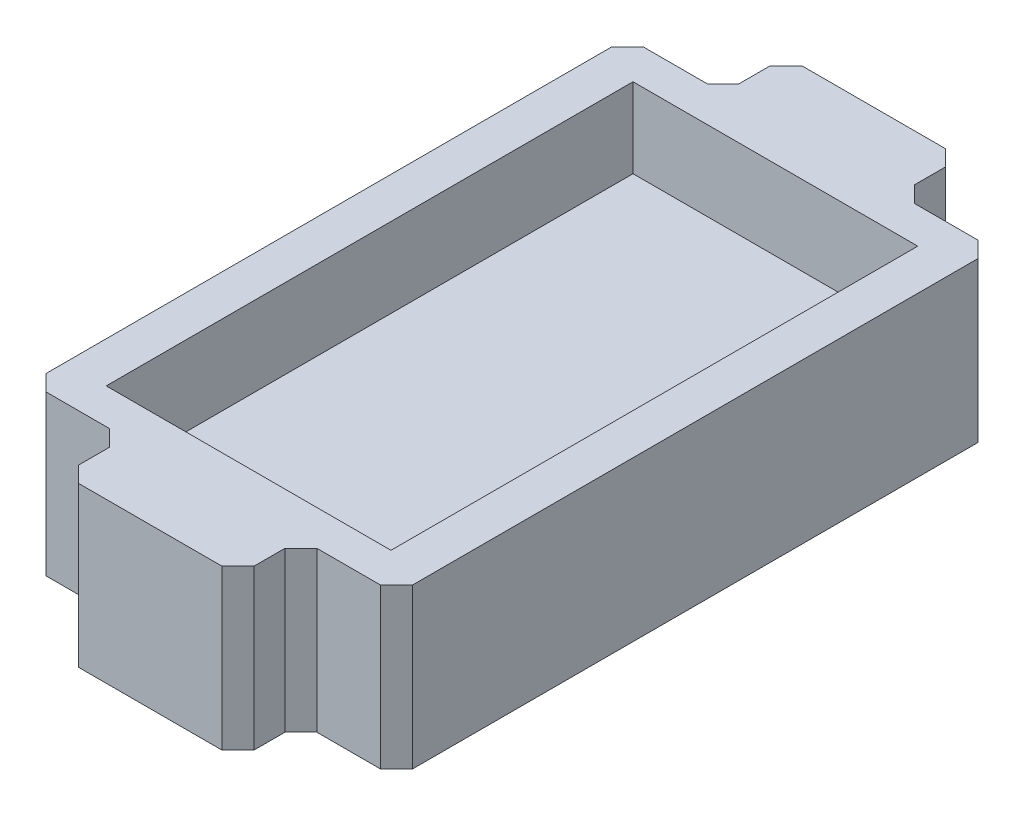
from build123d import *

# Parameters (mm, degrees)
SKETCH_1_W          = 5.5
SKETCH_1_H          = 3.95
EXTRUDE_1_DEPTH     = 10
CHAMFER_1_SIZE      = 1
SKETCH_2_W          = 8.93689146
SKETCH_2_H          = 16.533425066
CUT_EXTRUDE_1_DEPTH = 5


with BuildPart() as part:
    # ｽｹｯﾁ1 → ﾎﾞｽ - 押し出し1 (new body)
    with BuildSketch(Plane(origin=(0, 0, 0), x_dir=(1, 0, 0), z_dir=(0, 1, 0))):
        Polygon((0, 37.5), (0, 18.75), (23, 18.75), (23, 37.5), (17, 37.5), (11.5, 37.5), (6, 37.5), align=None)
        Polygon((0, 18.75), (0, 0), (6, 0), (11.5, 0), (17, 0), (23, 0), (23, 18.75), align=None)
        with Locations((14.25, -1.975)):
            Rectangle(SKETCH_1_W, SKETCH_1_H)
        with Locations((8.75, -1.975)):
            Rectangle(SKETCH_1_W, SKETCH_1_H)
        with Locations((14.25, 39.475)):
            Rectangle(SKETCH_1_W, SKETCH_1_H)
        with Locations((8.75, 39.475)):
            Rectangle(SKETCH_1_W, SKETCH_1_H)
    extrude(amount=EXTRUDE_1_DEPTH)

    # 面取り1
    chamfer_1_edges = [part.edges().sort_by_distance(p)[0] for p in [
        (6, 5, 3.95),
        (6, 5, 0),
        (0, 5, 0),
        (0, 5, -37.5),
        (6, 5, -37.5),
        (6, 5, -41.45),
        (17, 5, -41.45),
        (17, 5, -37.5),
        (23, 5, -37.5),
        (23, 5, 0),
        (17, 5, 0),
        (17, 5, 3.95),
    ]]
    chamfer(chamfer_1_edges, length=CHAMFER_1_SIZE)

    # ｽｹｯﾁ2 → ｶｯﾄ - 押し出し1 (cut)
    with BuildSketch(Plane(origin=(0, 10, 0), x_dir=(1, 0, 0), z_dir=(0, 1, 0))):
        with Locations((7.03155427, 10.483287467)):
            Rectangle(SKETCH_2_W, SKETCH_2_H)
        with Locations((15.96844573, 10.483287467)):
            Rectangle(SKETCH_2_W, SKETCH_2_H)
        with Locations((15.96844573, 27.016712533)):
            Rectangle(SKETCH_2_W, SKETCH_2_H)
        with Locations((7.03155427, 27.016712533)):
            Rectangle(SKETCH_2_W, SKETCH_2_H)
    extrude(amount=-CUT_EXTRUDE_1_DEPTH, mode=Mode.SUBTRACT)


solid = part.part
